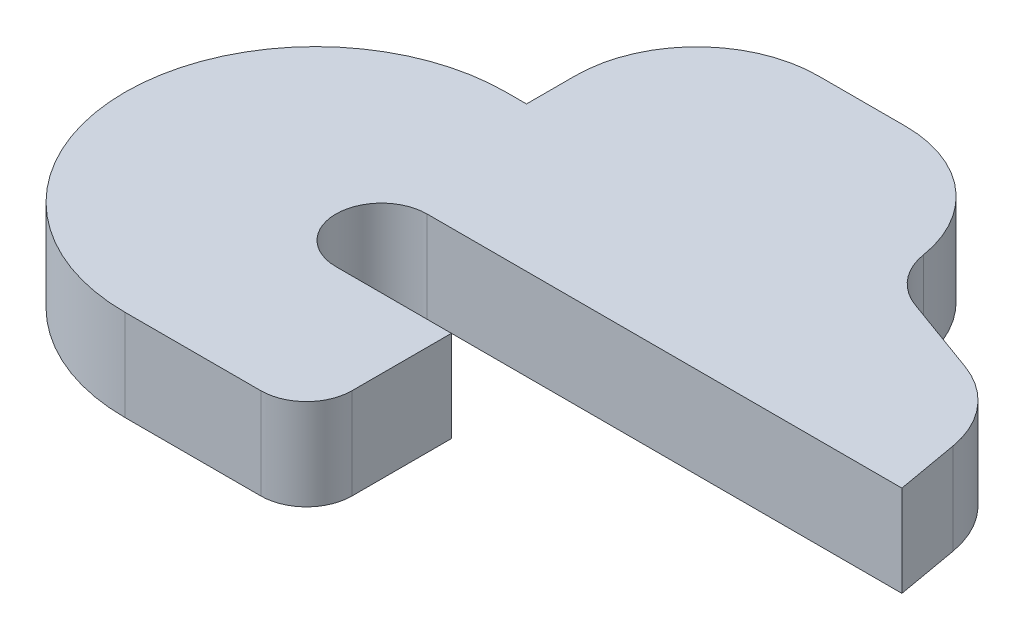
from build123d import *

# Parameters (mm, degrees)
BOSS_EXTRUDE2_DEPTH = 3


with BuildPart() as part:
    # Sketch1 → Boss-Extrude2 (new body)
    with BuildSketch(Plane(origin=(0, 0, 0), x_dir=(1, 0, 0), z_dir=(0, 1, 0))):
        with BuildLine():
            Line((0, 0), (-3.8, 0))
            ThreePointArc((-3.8, 0), (-5.3, 1.5), (-3.8, 3))
            Line((-3.8, 3), (11.82, 3))
            Line((11.82, 3), (11.458822115, 5.04834157))
            ThreePointArc((11.458822115, 5.04834157), (10.758482238, 6.549941992), (9.401032589, 7.5))
            Line((9.401032589, 7.5), (6.82, 8.438574292))
            ThreePointArc((6.82, 8.438574292), (5.961457646, 9.044534587), (5.528627211, 10.002104777))
            ThreePointArc((5.528627211, 10.002104777), (4.17422767, 12.413716405), (1.57888753, 13.37))
            Line((1.57888753, 13.37), (-1.3, 13.37))
            ThreePointArc((-1.3, 13.37), (-4.128427125, 12.198427125), (-5.3, 9.37))
            Line((-5.3, 9.37), (-5.3, 7.77))
            Line((-5.3, 7.77), (-5.97, 7.77))
            ThreePointArc((-5.97, 7.77), (-12.24, 1.5), (-5.97, -4.77))
            Line((-5.97, -4.77), (-1.5, -4.77))
            ThreePointArc((-1.5, -4.77), (-0.439339828, -4.330660172), (0, -3.27))
            Line((0, -3.27), (0, 0))
        make_face()
    extrude(amount=BOSS_EXTRUDE2_DEPTH)


solid = part.part
